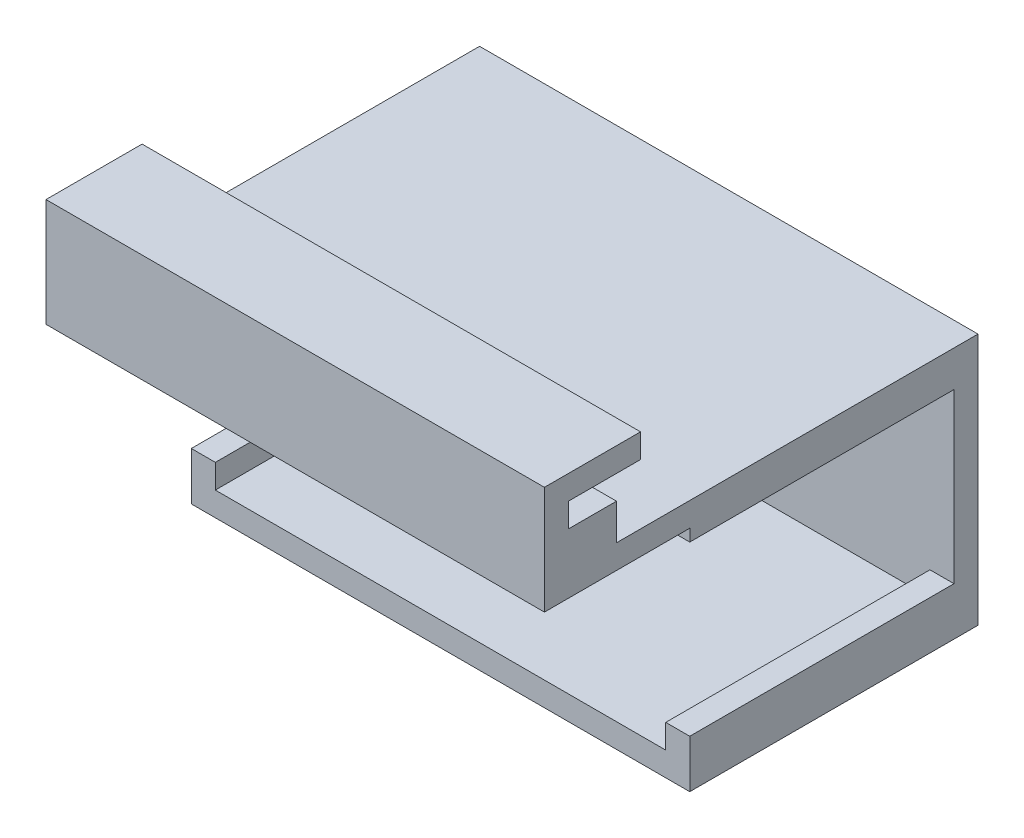
from build123d import *

# Parameters (mm, degrees)
SALIENTE_EXTRUIR1_DEPTH = 2
SALIENTE_EXTRUIR2_DEPTH = 24
CROQUIS4_W              = 26.838471133
CROQUIS4_H              = 14
CORTAR_EXTRUIR1_DEPTH   = 70.1
SALIENTE_EXTRUIR3_DEPTH = 2
SALIENTE_EXTRUIR4_DEPTH = 2
CROQUIS7_W              = 41.5
CROQUIS7_H              = 2
SALIENTE_EXTRUIR5_DEPTH = 8
SALIENTE_EXTRUIR6_DEPTH = 6


with BuildPart() as part:
    # Croquis1 → Saliente-Extruir1 (new body)
    with BuildSketch(Plane.XY):
        Polygon((-48.939551095, 26.503456625), (-8.439551095, 26.503456625), (-8.439551095, 6.503456625), (-8.439551095, 5.503456625), (-48.939551095, 5.503456625), (-49.939551095, 5.503456625), (-49.939551095, 26.503456625), align=None)
    extrude(amount=SALIENTE_EXTRUIR1_DEPTH)

    # Croquis3 → Saliente-Extruir2 (add)
    with BuildSketch(Plane.XY):
        Polygon((-48.939551095, 26.503456625), (-8.439551095, 26.503456625), (-8.439551095, 6.503456625), (-8.439551095, 5.503456625), (-48.939551095, 5.503456625), (-49.939551095, 5.503456625), (-49.939551095, 26.503456625), align=None)
        Polygon((-46.939551095, 7.503456625), (-47.939551095, 7.503456625), (-47.939551095, 24.503456625), (-46.939551095, 24.503456625), (-10.439551095, 24.503456625), (-10.439551095, 8.503456625), (-10.439551095, 7.503456625), align=None, mode=Mode.SUBTRACT)
    extrude(amount=SALIENTE_EXTRUIR2_DEPTH)

    # Croquis4 → Cortar-Extruir1 (cut)
    with BuildSketch(Plane(origin=(0, 0, 0), x_dir=(0, 0, -1), z_dir=(1, 0, 0))):
        with Locations((-15.419235567, 16.503456625)):
            Rectangle(CROQUIS4_W, CROQUIS4_H)
    extrude(amount=-CORTAR_EXTRUIR1_DEPTH, mode=Mode.SUBTRACT)

    # Croquis5 → Saliente-Extruir3 (add)
    with BuildSketch(Plane(origin=(0, 26.503456625, 0), x_dir=(1, 0, 0), z_dir=(0, 1, 0))):
        Polygon((-49.939551095, -20.607192887), (-8.439551095, -20.607192887), (-8.439551095, -24), (-8.439551095, -36.1), (-48.939551095, -36.1), (-49.939551095, -36.1), align=None)
    extrude(amount=-SALIENTE_EXTRUIR3_DEPTH)

    # Croquis6 → Saliente-Extruir4 (add)
    with BuildSketch(Plane.XY.offset(36.1)):
        Polygon((-8.439551095, 24.503456625), (-8.439551095, 33.503456625), (-48.939551095, 33.503456625), (-49.939551095, 33.503456625), (-49.939551095, 24.503456625), align=None)
    extrude(amount=-SALIENTE_EXTRUIR4_DEPTH)

    # Croquis7 → Saliente-Extruir5 (add)
    with BuildSketch(Plane.XY.offset(36.1)):
        with Locations((-29.189551095, 32.503456625)):
            Rectangle(CROQUIS7_W, CROQUIS7_H)
    extrude(amount=-SALIENTE_EXTRUIR5_DEPTH)

    # Croquis8 → Saliente-Extruir6 (add)
    with BuildSketch(Plane.XY.offset(36.1)):
        Polygon((-49.939551095, 29.503456625), (-49.939551095, 26.503456625), (-49.715027183, 26.503456625), (-8.439551095, 26.503456625), (-8.439551095, 29.503456625), (-49.715027183, 29.503456625), align=None)
    extrude(amount=-SALIENTE_EXTRUIR6_DEPTH)


solid = part.part
